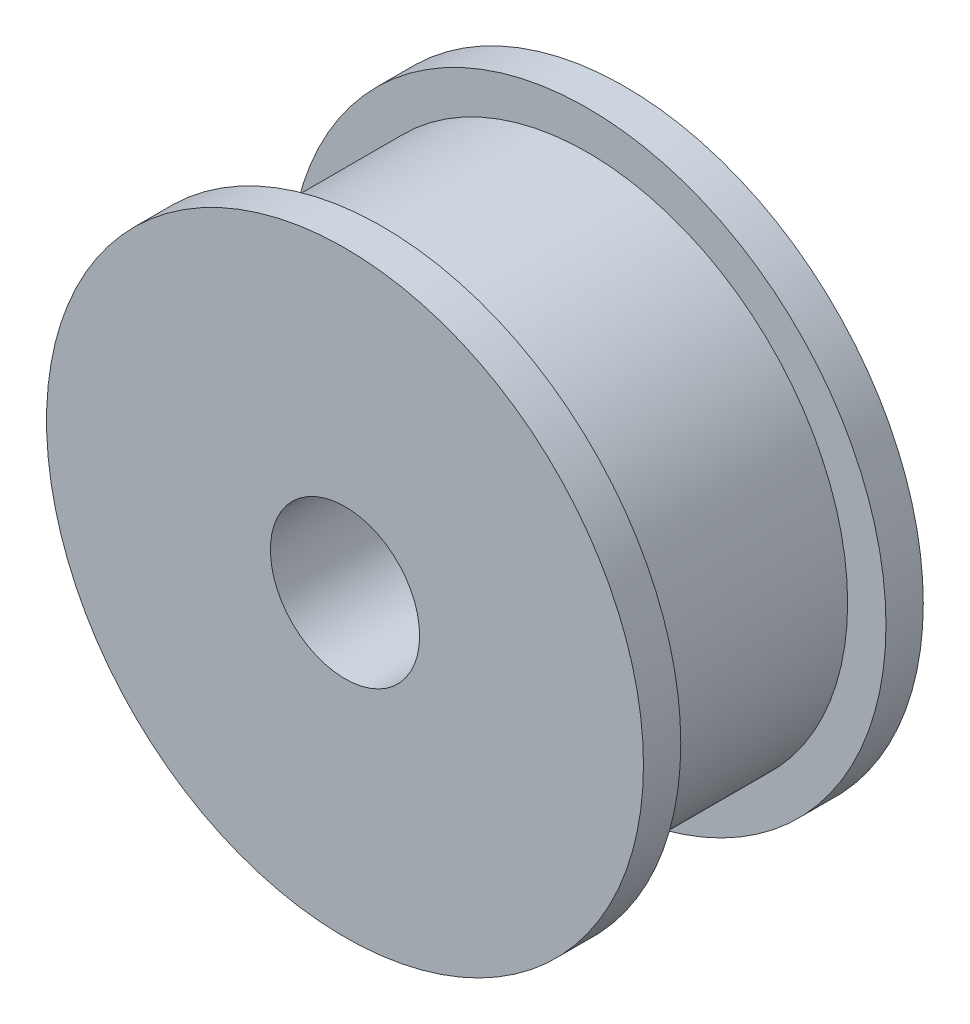
from build123d import *

# Parameters (mm, degrees)
SKETCH_1_R          = 16
EXTRUDE_1_DEPTH     = 2
SKETCH_2_R          = 13.945
EXTRUDE_2_DEPTH     = 11
SKETCH_3_R          = 16
EXTRUDE_3_DEPTH     = 2
SKETCH_4_R          = 4
CUT_EXTRUDE_1_DEPTH = 15
SKETCH_5_R          = 2
CUT_EXTRUDE_2_DEPTH = 20
SKETCH_8_R          = 2
CUT_EXTRUDE_3_DEPTH = 20


with BuildPart() as part:
    # 草图1 → 凸台-拉伸1 (new body)
    with BuildSketch(Plane.XY):
        Circle(SKETCH_1_R)
    extrude(amount=EXTRUDE_1_DEPTH)

    # 草图2 → 凸台-拉伸2 (add)
    with BuildSketch(Plane.XY.offset(2)):
        Circle(SKETCH_2_R)
    extrude(amount=EXTRUDE_2_DEPTH)

    # 草图3 → 凸台-拉伸3 (add)
    with BuildSketch(Plane.XY.offset(13)):
        Circle(SKETCH_3_R)
    extrude(amount=EXTRUDE_3_DEPTH)

    # 草图4 → 切除-拉伸1 (cut)
    with BuildSketch(Plane.XY.offset(15)):
        Circle(SKETCH_4_R)
    extrude(amount=-CUT_EXTRUDE_1_DEPTH, mode=Mode.SUBTRACT)

    # 草图5 → 切除-拉伸2 (cut)
    with BuildSketch(Plane(origin=(0, 0, 0), x_dir=(1, 0, 0), z_dir=(0, 1, 0))):
        with Locations(Location((0, -7.5, 0), (0, 0, 270))):
            Circle(SKETCH_5_R)
    extrude(amount=-CUT_EXTRUDE_2_DEPTH, mode=Mode.SUBTRACT)

    # 草图8 → 切除-拉伸3 (cut)
    with BuildSketch(Plane(origin=(0, 0, 0), x_dir=(0, 0, -1), z_dir=(1, 0, 0))):
        with Locations((-7.5, 0)):
            Circle(SKETCH_8_R)
    extrude(amount=-CUT_EXTRUDE_3_DEPTH, mode=Mode.SUBTRACT)


solid = part.part
